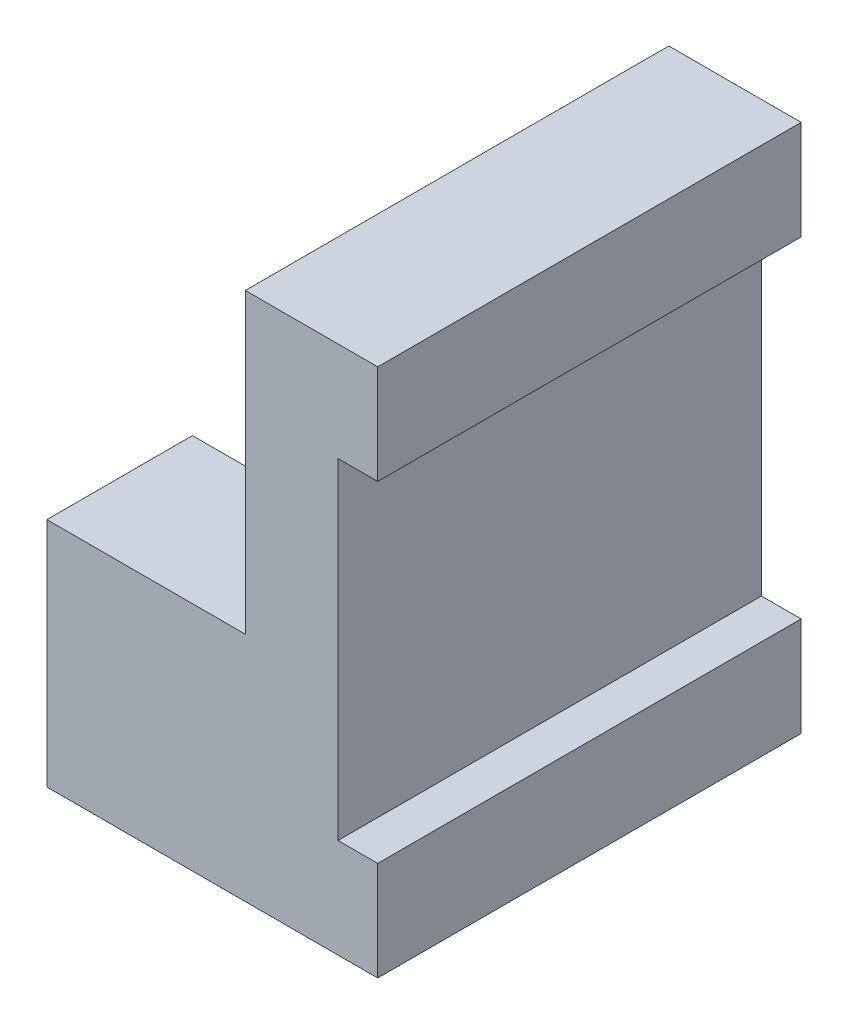
from build123d import *

# Parameters (mm, degrees)
BOSS_EXTRUDE1_DEPTH = 64
SKETCH4_W           = 20
SKETCH4_H           = 35
CUT_EXTRUDE2_DEPTH  = 22


with BuildPart() as part:
    # Sketch2 → Boss-Extrude1 (new body)
    with BuildSketch(Plane.XY):
        Polygon((0, 0), (50, 0), (50, 15), (44, 15), (44, 65), (50, 65), (50, 80), (30, 80), (30, 35), (0, 35), align=None)
    extrude(amount=BOSS_EXTRUDE1_DEPTH)

    # Sketch4 → Cut-Extrude2 (cut)
    with BuildSketch(Plane.ZY):
        with Locations((32, 17.5)):
            Rectangle(SKETCH4_W, SKETCH4_H)
    extrude(amount=-CUT_EXTRUDE2_DEPTH, mode=Mode.SUBTRACT)


solid = part.part
